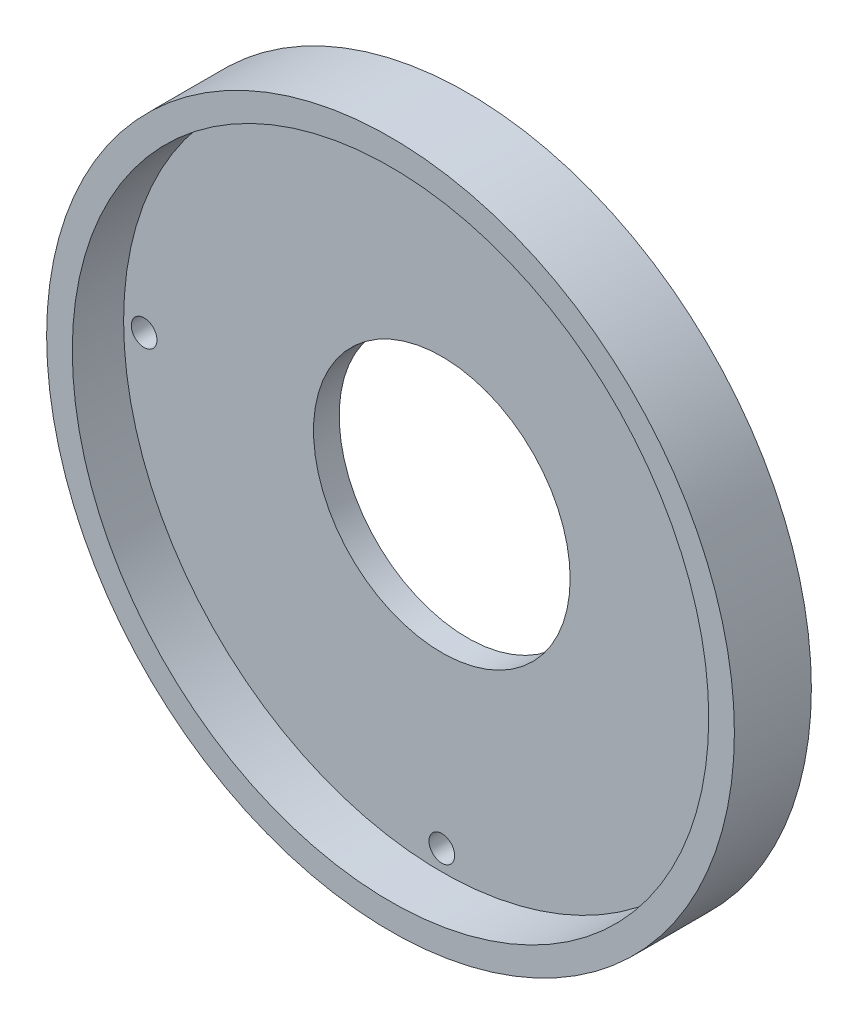
from build123d import *

# Parameters (mm, degrees)
SKETCH1_R               = 67
SKETCH1_R_2             = 2.5
BOSS_EXTRUDE1_DEPTH     = 5
SKETCH3_R               = 25
CUT_EXTRUDE1_DEPTH      = 10
SKETCH4_R               = 67
SKETCH4_R_2             = 62
BOSS_EXTRUDE2_DEPTH     = 10
CUT_EXTRUDE4_DEPTH      = 121
CUT_EXTRUDE4_DEPTH_BACK = 121
SKETCH7_R               = 1.25


with BuildPart() as part:
    # Sketch1 → Boss-Extrude1 (new body)
    with BuildSketch(Plane.XY):
        Circle(SKETCH1_R)
        with Locations((0, 58)):
            Circle(SKETCH1_R_2, mode=Mode.SUBTRACT)
        with Locations((58, 0)):
            Circle(SKETCH1_R_2, mode=Mode.SUBTRACT)
        with Locations((0, -58)):
            Circle(SKETCH1_R_2, mode=Mode.SUBTRACT)
        with Locations((-58, 0)):
            Circle(SKETCH1_R_2, mode=Mode.SUBTRACT)
    extrude(amount=BOSS_EXTRUDE1_DEPTH)

    # Sketch3 → Cut-Extrude1 (cut)
    with BuildSketch(Plane.XY.offset(5)):
        Circle(SKETCH3_R)
    extrude(amount=-CUT_EXTRUDE1_DEPTH, mode=Mode.SUBTRACT)

    # Sketch4 → Boss-Extrude2 (add)
    with BuildSketch(Plane.XY.offset(5)):
        Circle(SKETCH4_R)
        Circle(SKETCH4_R_2, mode=Mode.SUBTRACT)
    extrude(amount=BOSS_EXTRUDE2_DEPTH)

    # Sketch7 → Cut-Extrude4 (cut, two sides: drawn at the far end of the back side and taken through both)
    with BuildSketch(Plane(origin=(0, 0, 0), x_dir=(0.7071067811865477, 0.7071067811865475, 0), z_dir=(-0.7071067811865475, 0.7071067811865477, 0)).offset(-CUT_EXTRUDE4_DEPTH_BACK)):
        with Locations((0, -10)):
            Circle(SKETCH7_R)
    extrude(amount=CUT_EXTRUDE4_DEPTH + CUT_EXTRUDE4_DEPTH_BACK, mode=Mode.SUBTRACT)


solid = part.part
